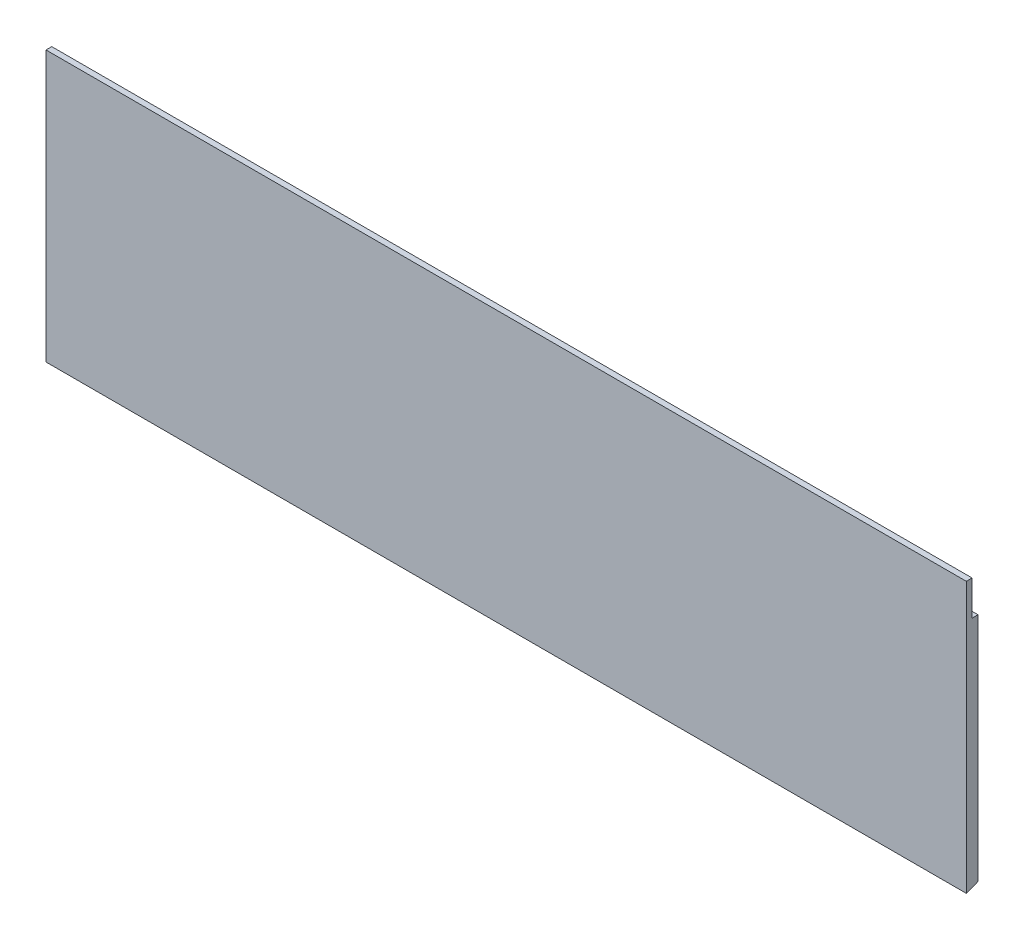
from build123d import *

# Parameters (mm, degrees)
SKETCH1_W           = 1262
SKETCH1_H           = 370.62
BOSS_EXTRUDE1_DEPTH = 16
SKETCH2_W           = 1262
SKETCH2_H           = 47.7
CUT_EXTRUDE1_DEPTH  = 8.1
CUT_EXTRUDE2_DEPTH  = 1276.633096192


with BuildPart() as part:
    # Sketch1 → Boss-Extrude1 (new body)
    with BuildSketch(Plane.XY):
        Rectangle(SKETCH1_W, SKETCH1_H)
    extrude(amount=BOSS_EXTRUDE1_DEPTH)

    # Sketch2 → Cut-Extrude1 (cut)
    with BuildSketch(Plane(origin=(0, 0, 0), x_dir=(-1, 0, 0), z_dir=(0, 0, -1))):
        with Locations((0, 161.46)):
            Rectangle(SKETCH2_W, SKETCH2_H)
    extrude(amount=-CUT_EXTRUDE1_DEPTH, mode=Mode.SUBTRACT)

    # Sketch3 → Cut-Extrude2 (cut, through all)
    with BuildSketch(Plane(origin=(631, 0, 0), x_dir=(0, 0, -1), z_dir=(1, 0, 0))):
        Polygon((-16, -185.31), (0, -179.168175439), (0, -185.31), align=None)
    extrude(amount=-CUT_EXTRUDE2_DEPTH, mode=Mode.SUBTRACT)


solid = part.part
